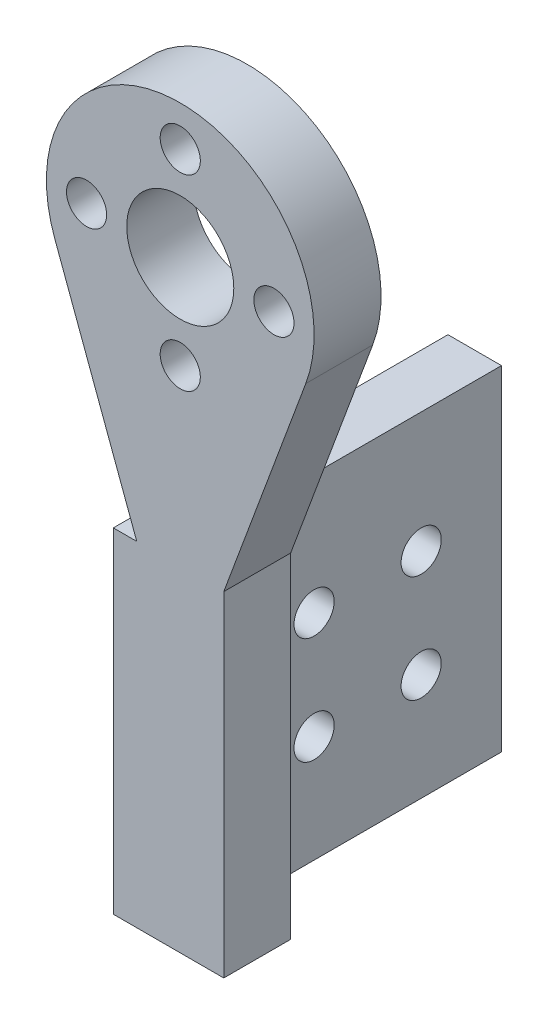
from build123d import *

# Parameters (mm, degrees)
SKETCH_1_R          = 1.25
EXTRUDE_1_DEPTH     = 5
SKETCH_2_W          = 5
SKETCH_2_H          = 25
EXTRUDE_2_DEPTH     = 4
SKETCH_3_W          = 4
SKETCH_3_H          = 25
EXTRUDE_3_DEPTH     = 20
SKETCH_4_R          = 1.5
CUT_EXTRUDE_1_DEPTH = 20
EXTRUDE_START       = -5
SKETCH_7_R          = 1.25
EXTRUDE_4_DEPTH     = 5
SKETCH_8_R          = 1.5
SKETCH_8_R_2        = 4
EXTRUDE_5_DEPTH     = 5
EXTRUDE_START_2     = 4
SKETCH_14_W         = 25
SKETCH_14_H         = 25
SKETCH_14_R         = 1.5
EXTRUDE_9_DEPTH     = 4
SKETCH_15_W         = 4
SKETCH_15_H         = 25
CUT_EXTRUDE_2_DEPTH = 100
SKETCH_19_W         = 1.750049733
SKETCH_19_H         = 25
EXTRUDE_10_DEPTH    = 20
SKETCH_20_R         = 1.5
CUT_EXTRUDE_3_DEPTH = 20
SKETCH_21_W         = 25
SKETCH_21_H         = 25
CUT_EXTRUDE_4_DEPTH = 4
SKETCH_22_W         = 1.750049733
SKETCH_22_H         = 25
EXTRUDE_11_DEPTH    = 5


with BuildPart() as part:
    # 草图1 → 凸台-拉伸1 (new body)
    with BuildSketch(Plane.XY):
        Polygon((-3.581151343, -8.027992706), (-3.581151343, -12.611885422), (2.918848657, -12.611885422), (2.918848657, -6.641886627), (2.918848657, 12.388114578), (-3.581151343, 12.388114578), align=None)
        with Locations((-0.081151343, 8.237522913)):
            Circle(SKETCH_1_R, mode=Mode.SUBTRACT)
        with Locations((-0.081151343, 2.787522913)):
            Circle(SKETCH_1_R, mode=Mode.SUBTRACT)
        with Locations((-0.081151343, -2.662477087)):
            Circle(SKETCH_1_R, mode=Mode.SUBTRACT)
        with Locations((-0.000846901, -8.111885422)):
            Circle(SKETCH_1_R, mode=Mode.SUBTRACT)
    extrude(amount=EXTRUDE_1_DEPTH)

    # 草图2 → 凸台-拉伸2 (add)
    with BuildSketch(Plane.ZY.offset(3.581151343)):
        with Locations((2.5, -0.111885422)):
            Rectangle(SKETCH_2_W, SKETCH_2_H)
    extrude(amount=EXTRUDE_2_DEPTH)

    # 草图3 → 凸台-拉伸3 (add)
    with BuildSketch(Plane(origin=(0, 0, 0), x_dir=(-1, 0, 0), z_dir=(0, 0, -1))):
        with Locations((5.581151343, -0.111885422)):
            Rectangle(SKETCH_3_W, SKETCH_3_H)
    extrude(amount=EXTRUDE_3_DEPTH)

    # 草图4 → 切除-拉伸1 (cut)
    with BuildSketch(Plane(origin=(-3.581151343, 0, 0), x_dir=(0, 0, -1), z_dir=(1, 0, 0))):
        with Locations(Location((6, 3.388114578, 0), (0, 0, 90))):
            Circle(SKETCH_4_R)
        with Locations(Location((14, 3.388114578, 0), (0, 0, 180))):
            Circle(SKETCH_4_R)
        with Locations(Location((14, -4.611885422, 0), (0, 0, 90))):
            Circle(SKETCH_4_R)
        with Locations(Location((6, -4.611885422, 0), (0, 0, 180))):
            Circle(SKETCH_4_R)
    extrude(amount=-CUT_EXTRUDE_1_DEPTH, mode=Mode.SUBTRACT)

    # 草图7 → 凸台-拉伸4 (add)
    with BuildSketch(Plane.XY.offset(5).offset(EXTRUDE_START)):
        with Locations((-0.081151343, 8.237522913)):
            Circle(SKETCH_7_R)
        with Locations((-0.081151343, 2.787522913)):
            Circle(SKETCH_7_R)
        with Locations((-0.081151343, -2.662477087)):
            Circle(SKETCH_7_R)
        with Locations((-0.000846901, -8.111885422)):
            Circle(SKETCH_7_R)
    extrude(amount=EXTRUDE_4_DEPTH)

    # 草图8 → 凸台-拉伸5 (add)
    with BuildSketch(Plane.XY.offset(5)):
        with BuildLine():
            ThreePointArc((9.045368421, 28.911309576), (-0.331303735, 42.388418969), (-9.707833242, 28.911210329))
            Line((-9.707833242, 28.911210329), (-3.581151343, 12.388114578))
            Line((-3.581151343, 12.388114578), (2.918848657, 12.388114578))
            Line((2.918848657, 12.388114578), (9.045368421, 28.911309576))
        make_face()
        with Locations((-0.33125081, 25.388000558)):
            Circle(SKETCH_8_R, mode=Mode.SUBTRACT)
        with Locations((-7.33125081, 32.388000558)):
            Circle(SKETCH_8_R, mode=Mode.SUBTRACT)
        with Locations((-0.33125081, 32.388000558)):
            Circle(SKETCH_8_R_2, mode=Mode.SUBTRACT)
        with Locations((-0.33125081, 39.388000558)):
            Circle(SKETCH_8_R, mode=Mode.SUBTRACT)
        with Locations((6.668848657, 32.388114578)):
            Circle(SKETCH_8_R, mode=Mode.SUBTRACT)
    extrude(amount=-EXTRUDE_5_DEPTH)

    # 草图14 → 凸台-拉伸9 (add)
    with BuildSketch(Plane(origin=(2.918848657, 0, 0), x_dir=(0, 0, -1), z_dir=(1, 0, 0)).offset(EXTRUDE_START_2)):
        with Locations((7.5, -0.111885422)):
            Rectangle(SKETCH_14_W, SKETCH_14_H)
        with Locations(Location((6, 3.388114578, 0), (0, 0, 90))):
            Circle(SKETCH_14_R, mode=Mode.SUBTRACT)
        with Locations(Location((14, 3.388114578, 0), (0, 0, 180))):
            Circle(SKETCH_14_R, mode=Mode.SUBTRACT)
        with Locations(Location((14, -4.611885422, 0), (0, 0, 90))):
            Circle(SKETCH_14_R, mode=Mode.SUBTRACT)
        with Locations(Location((6, -4.611885422, 0), (0, 0, 180))):
            Circle(SKETCH_14_R, mode=Mode.SUBTRACT)
    extrude(amount=-EXTRUDE_9_DEPTH)

    # 草图15 → 切除-拉伸2 (cut)
    with BuildSketch(Plane(origin=(0, 0, -20), x_dir=(-1, 0, 0), z_dir=(0, 0, -1))):
        with Locations((5.581151343, -0.111885422)):
            Rectangle(SKETCH_15_W, SKETCH_15_H)
    extrude(amount=-CUT_EXTRUDE_2_DEPTH, mode=Mode.SUBTRACT)

    # 草图19 → 凸台-拉伸10 (add)
    with BuildSketch(Plane(origin=(0, 0, 0), x_dir=(-1, 0, 0), z_dir=(0, 0, -1))):
        with Locations((4.45617621, -0.111885422)):
            Rectangle(SKETCH_19_W, SKETCH_19_H)
        Polygon((1.331201076, 12.388114578), (1.331201076, 9.888057568), (1.331201076, -12.611885422), (3.581151343, -12.611885422), (3.581151343, 12.388114578), align=None)
    extrude(amount=EXTRUDE_10_DEPTH)

    # 草图20 → 切除-拉伸3 (cut)
    with BuildSketch(Plane(origin=(6.918848657, 0, 0), x_dir=(0, 0, -1), z_dir=(1, 0, 0))):
        with Locations(Location((6, 3.388114578, 0), (0, 0, 90))):
            Circle(SKETCH_20_R)
        with Locations(Location((14, 3.388114578, 0), (0, 0, 90))):
            Circle(SKETCH_20_R)
        with Locations(Location((6, -4.611885422, 0), (0, 0, 90))):
            Circle(SKETCH_20_R)
        with Locations(Location((14, -4.611885422, 0), (0, 0, 90))):
            Circle(SKETCH_20_R)
    extrude(amount=-CUT_EXTRUDE_3_DEPTH, mode=Mode.SUBTRACT)

    # 草图21 → 切除-拉伸4 (cut)
    with BuildSketch(Plane(origin=(6.918848657, 0, 0), x_dir=(0, 0, -1), z_dir=(1, 0, 0))):
        with Locations((7.5, -0.111885422)):
            Rectangle(SKETCH_21_W, SKETCH_21_H)
    extrude(amount=-CUT_EXTRUDE_4_DEPTH, mode=Mode.SUBTRACT)

    # 草图22 → 凸台-拉伸11 (add)
    with BuildSketch(Plane.XY):
        with Locations((-4.45617621, -0.111885422)):
            Rectangle(SKETCH_22_W, SKETCH_22_H)
    extrude(amount=EXTRUDE_11_DEPTH)


solid = part.part
